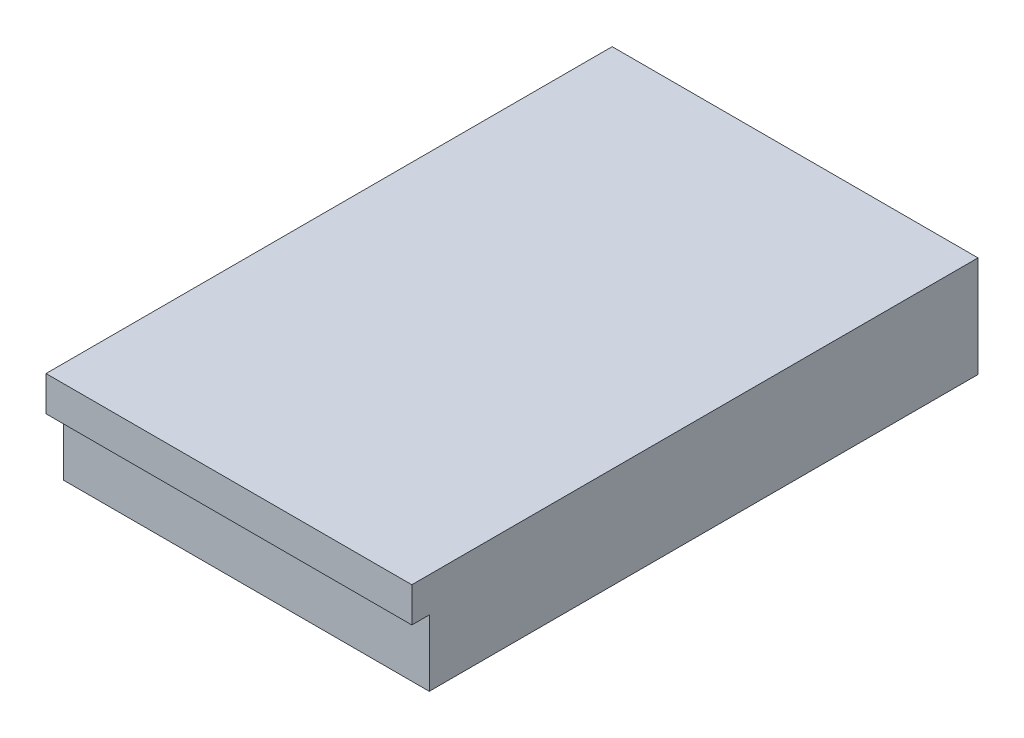
from build123d import *

# Parameters (mm, degrees)
SKETCH1_W           = 53.34
SKETCH1_H           = 80.01
BOSS_EXTRUDE1_DEPTH = 14.732
SKETCH2_W           = 53.34
SKETCH2_H           = 5.08
BOSS_EXTRUDE2_DEPTH = 2.54


with BuildPart() as part:
    # Sketch1 → Boss-Extrude1 (new body)
    with BuildSketch(Plane(origin=(0, 0, 0), x_dir=(1, 0, 0), z_dir=(0, 1, 0))):
        Rectangle(SKETCH1_W, SKETCH1_H)
    extrude(amount=BOSS_EXTRUDE1_DEPTH)

    # Sketch2 → Boss-Extrude2 (add)
    with BuildSketch(Plane.XY.offset(40.005)):
        with Locations((0, 12.192)):
            Rectangle(SKETCH2_W, SKETCH2_H)
    extrude(amount=BOSS_EXTRUDE2_DEPTH)


solid = part.part
